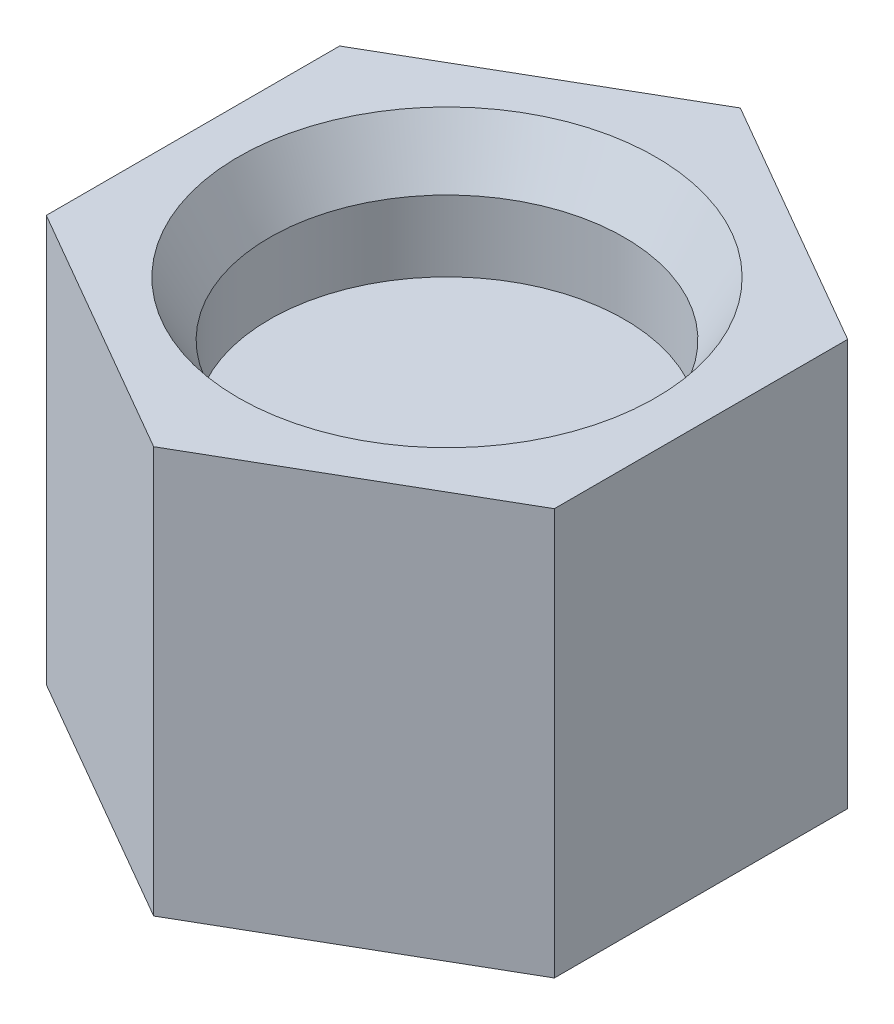
from build123d import *

# Parameters (mm, degrees)
SKETCH1_R           = 11.35
BOSS_EXTRUDE1_DEPTH = 6
BOSS_EXTRUDE4_DEPTH = 20
CUT_EXTRUDE2_DEPTH  = 15
CHAMFER3_SIZE       = 2
CHAMFER3_SIZE2      = 3.464101615
CUT_EXTRUDE4_START  = -2
SKETCH9_R           = 11.35
CUT_EXTRUDE4_DEPTH  = 2


with BuildPart() as part:
    # Sketch1 → Boss-Extrude1 (new body)
    with BuildSketch(Plane(origin=(0, 0, 0), x_dir=(1, 0, 0), z_dir=(0, 1, 0))):
        Polygon((16.25, 9.381941874), (0, 18.763883749), (-16.25, 9.381941874), (-16.25, -9.381941874), (0, -18.763883749), (16.25, -9.381941874), align=None)
        Circle(SKETCH1_R, mode=Mode.SUBTRACT)
    extrude(amount=BOSS_EXTRUDE1_DEPTH)

    # Sketch5 → Boss-Extrude4 (add)
    with BuildSketch(Plane.XZ):
        Polygon((16.25, 9.381941874), (0, 18.763883749), (-16.25, 9.381941874), (-16.25, -9.381941874), (0, -18.763883749), (16.25, -9.381941874), align=None)
    extrude(amount=BOSS_EXTRUDE4_DEPTH)

    # Sketch6 → Cut-Extrude2 (cut)
    with BuildSketch(Plane.XZ.offset(20)):
        with BuildLine():
            ThreePointArc((-2.618090908, -1.66), (3.1, 0), (-2.618090908, 1.66))
            Line((-2.618090908, 1.66), (-2.618090908, -1.66))
        make_face()
    extrude(amount=-CUT_EXTRUDE2_DEPTH, mode=Mode.SUBTRACT)

    # Chamfer3
    chamfer3_edges = [part.edges().sort_by_distance(p)[0] for p in [
        (-11.35, 6, 0),
    ]]
    chamfer3_side = [part.faces().sort_by_distance(p)[0] for p in [
        (7.87677715, 6, -13.642978223),
    ]]
    chamfer(chamfer3_edges, length=CHAMFER3_SIZE, length2=CHAMFER3_SIZE2, reference=chamfer3_side[0])

    # Sketch9 → Cut-Extrude4 (cut)
    with BuildSketch(Plane(origin=(0, 0, 0), x_dir=(1, 0, 0), z_dir=(0, 1, 0)).offset(CUT_EXTRUDE4_START)):
        Circle(SKETCH9_R)
    extrude(amount=CUT_EXTRUDE4_DEPTH, mode=Mode.SUBTRACT)


solid = part.part
